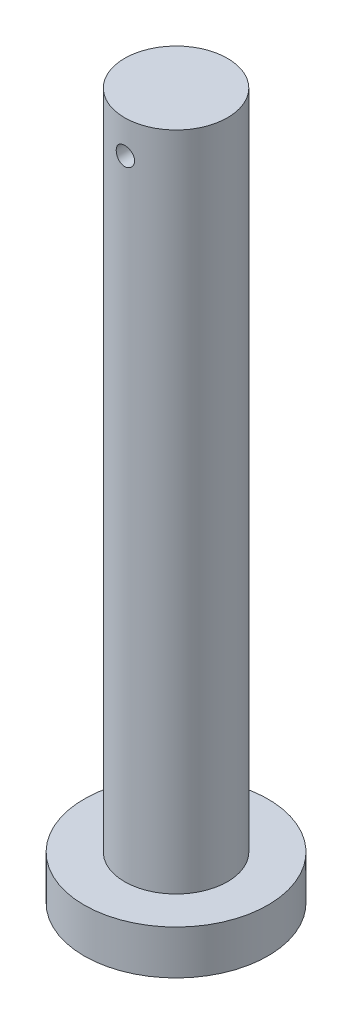
from build123d import *

# Parameters (mm, degrees)
SKETCH1_R           = 25
BOSS_EXTRUDE1_DEPTH = 12
SKETCH2_R           = 14
BOSS_EXTRUDE2_DEPTH = 180
SKETCH3_R           = 2.5
CUT_EXTRUDE1_DEPTH  = 90


with BuildPart() as part:
    # Sketch1 → Boss-Extrude1 (new body)
    with BuildSketch(Plane(origin=(0, 0, 0), x_dir=(1, 0, 0), z_dir=(0, 1, 0))):
        with Locations(Location((0, 0, 0), (0, 0, 270))):
            Circle(SKETCH1_R)
    extrude(amount=BOSS_EXTRUDE1_DEPTH)

    # Sketch2 → Boss-Extrude2 (add)
    with BuildSketch(Plane(origin=(0, 12, 0), x_dir=(1, 0, 0), z_dir=(0, 1, 0))):
        with Locations(Location((0, 0, 0), (0, 0, 90))):
            Circle(SKETCH2_R)
    extrude(amount=BOSS_EXTRUDE2_DEPTH)

    # Sketch3 → Cut-Extrude1 (cut, symmetric)
    with BuildSketch(Plane.XY):
        with Locations(Location((0, 183, 0), (0, 0, 90.000000007))):
            Circle(SKETCH3_R)
    extrude(amount=CUT_EXTRUDE1_DEPTH, both=True, mode=Mode.SUBTRACT)


solid = part.part
